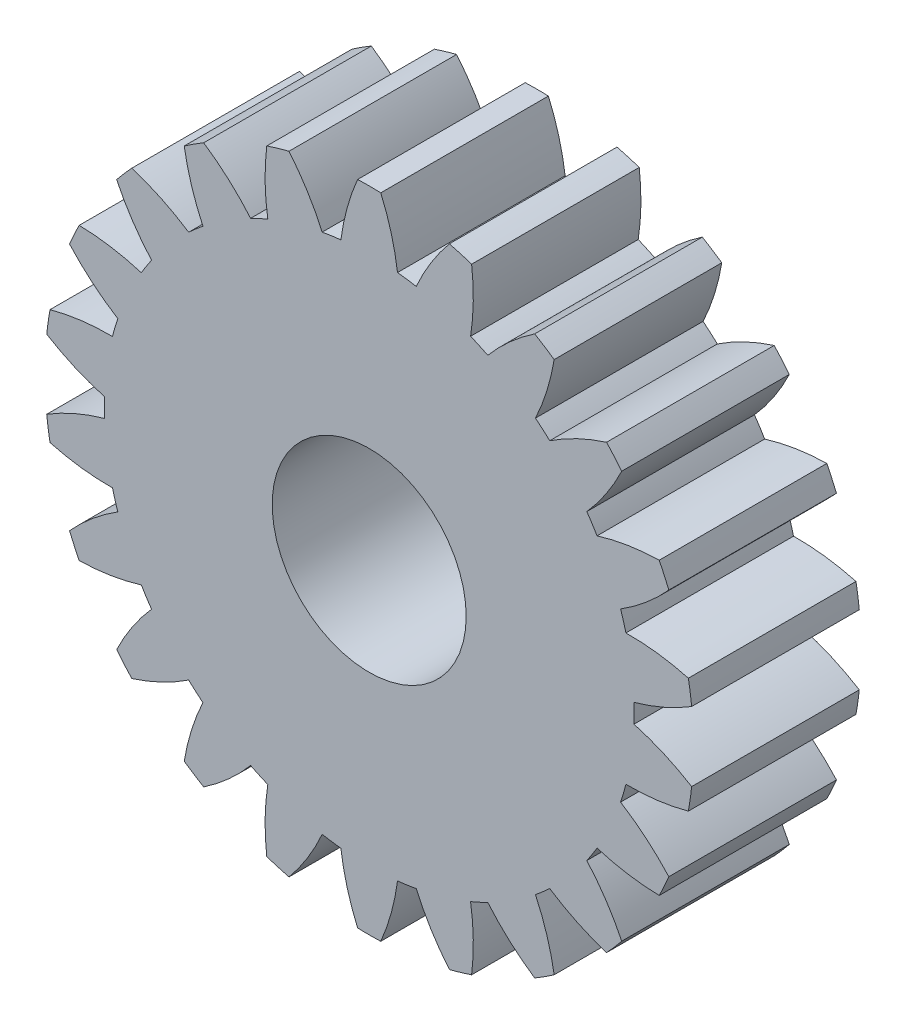
from build123d import *

# Parameters (mm, degrees)
SKETCH1_R           = 3.675
BOSS_EXTRUDE1_DEPTH = 6.35


with BuildPart() as part:
    # Sketch1 → Boss-Extrude1 (new body)
    with BuildSketch(Plane.XY.offset(6.35)):
        with BuildLine():
            ThreePointArc((-3.880007235, 11.657556143), (-3.94321083, 10.464048215), (-3.841100867, 9.273237808))
            ThreePointArc((-3.841100867, 9.273237808), (-4.169636916, 9.130231284), (-4.492859393, 8.975589663))
            ThreePointArc((-4.492859393, 8.975589663), (-5.325946046, 9.8325742), (-6.269328707, 10.566389588))
            ThreePointArc((-6.269328707, 10.566389588), (-6.642473156, 10.335889983), (-7.007152779, 10.092218849))
            ThreePointArc((-7.007152779, 10.092218849), (-6.731546143, 8.929249868), (-6.298082291, 7.815443351))
            ThreePointArc((-6.298082291, 7.815443351), (-6.573020728, 7.585670296), (-6.839582844, 7.346230451))
            ThreePointArc((-6.839582844, 7.346230451), (-7.880364079, 7.933793461), (-8.992272799, 8.37210256))
            ThreePointArc((-8.992272799, 8.37210256), (-9.285363033, 8.045812868), (-9.566620477, 7.709270006))
            ThreePointArc((-9.566620477, 7.709270006), (-8.974531622, 6.671056802), (-8.244830544, 5.724488154))
            ThreePointArc((-8.244830544, 5.724488154), (-8.443897491, 5.426563413), (-8.632203969, 5.121723338))
            ThreePointArc((-8.632203969, 5.121723338), (-9.79636188, 5.392263959), (-10.986716428, 5.499557573))
            ThreePointArc((-10.986716428, 5.499557573), (-11.176008019, 5.103911846), (-11.351057479, 4.701761955))
            ThreePointArc((-11.351057479, 4.701761955), (-10.490453922, 3.872414387), (-9.523631659, 3.169768972))
            ThreePointArc((-9.523631659, 3.169768972), (-9.630699898, 2.827828636), (-9.725495267, 2.48228466))
            ThreePointArc((-9.725495267, 2.48228466), (-10.918716703, 2.4138853), (-12.091081632, 2.181471139))
            ThreePointArc((-12.091081632, 2.181471139), (-12.161239301, 1.74852224), (-12.215899311, 1.313345113))
            ThreePointArc((-12.215899311, 1.313345113), (-11.156502035, 0.76005199), (-10.030884778, 0.358253958))
            ThreePointArc((-10.030884778, 0.358253958), (-10.037280275, 0), (-10.030884778, -0.358253958))
            ThreePointArc((-10.030884778, -0.358253958), (-11.156502035, -0.76005199), (-12.215899311, -1.313345113))
            ThreePointArc((-12.215899311, -1.313345113), (-12.161239301, -1.74852224), (-12.091081632, -2.181471139))
            ThreePointArc((-12.091081632, -2.181471139), (-10.918716703, -2.4138853), (-9.725495267, -2.48228466))
            ThreePointArc((-9.725495267, -2.48228466), (-9.630699898, -2.827828636), (-9.523631659, -3.169768972))
            ThreePointArc((-9.523631659, -3.169768972), (-10.490453922, -3.872414387), (-11.351057479, -4.701761955))
            ThreePointArc((-11.351057479, -4.701761955), (-11.176008019, -5.103911846), (-10.986716428, -5.499557573))
            ThreePointArc((-10.986716428, -5.499557573), (-9.79636188, -5.392263959), (-8.632203969, -5.121723338))
            ThreePointArc((-8.632203969, -5.121723338), (-8.443897491, -5.426563413), (-8.244830544, -5.724488154))
            ThreePointArc((-8.244830544, -5.724488154), (-8.974531622, -6.671056802), (-9.566620477, -7.709270006))
            ThreePointArc((-9.566620477, -7.709270006), (-9.285363033, -8.045812868), (-8.992272799, -8.37210256))
            ThreePointArc((-8.992272799, -8.37210256), (-7.880364079, -7.933793461), (-6.839582844, -7.346230451))
            ThreePointArc((-6.839582844, -7.346230451), (-6.573020728, -7.585670296), (-6.298082291, -7.815443351))
            ThreePointArc((-6.298082291, -7.815443351), (-6.731546143, -8.929249868), (-7.007152779, -10.092218849))
            ThreePointArc((-7.007152779, -10.092218849), (-6.642473156, -10.335889983), (-6.269328707, -10.566389588))
            ThreePointArc((-6.269328707, -10.566389588), (-5.325946046, -9.8325742), (-4.492859393, -8.975589663))
            ThreePointArc((-4.492859393, -8.975589663), (-4.169636916, -9.130231284), (-3.841100867, -9.273237808))
            ThreePointArc((-3.841100867, -9.273237808), (-3.94321083, -10.464048215), (-3.880007235, -11.657556143))
            ThreePointArc((-3.880007235, -11.657556143), (-3.461449609, -11.788614761), (-3.038480888, -11.904650573))
            ThreePointArc((-3.038480888, -11.904650573), (-2.340051539, -10.934778255), (-1.782151195, -9.87779998))
            ThreePointArc((-1.782151195, -9.87779998), (-1.428453919, -9.935115234), (-1.072936295, -9.979769688))
            ThreePointArc((-1.072936295, -9.979769688), (-0.835420026, -11.151111607), (-0.438526581, -12.278467567))
            ThreePointArc((-0.438526581, -12.278467567), (0, -12.28629608), (0.438526581, -12.278467567))
            ThreePointArc((0.438526581, -12.278467567), (0.835420026, -11.151111607), (1.072936295, -9.979769688))
            ThreePointArc((1.072936295, -9.979769688), (1.428453919, -9.935115234), (1.782151195, -9.87779998))
            ThreePointArc((1.782151195, -9.87779998), (2.340051539, -10.934778255), (3.038480888, -11.904650573))
            ThreePointArc((3.038480888, -11.904650573), (3.461449609, -11.788614761), (3.880007235, -11.657556143))
            ThreePointArc((3.880007235, -11.657556143), (3.94321083, -10.464048215), (3.841100867, -9.273237808))
            ThreePointArc((3.841100867, -9.273237808), (4.169636916, -9.130231284), (4.492859393, -8.975589663))
            ThreePointArc((4.492859393, -8.975589663), (5.325946046, -9.8325742), (6.269328707, -10.566389588))
            ThreePointArc((6.269328707, -10.566389588), (6.642473156, -10.335889983), (7.007152779, -10.092218849))
            ThreePointArc((7.007152779, -10.092218849), (6.731546143, -8.929249868), (6.298082291, -7.815443351))
            ThreePointArc((6.298082291, -7.815443351), (6.573020728, -7.585670296), (6.839582844, -7.346230451))
            ThreePointArc((6.839582844, -7.346230451), (7.880364079, -7.933793461), (8.992272799, -8.37210256))
            ThreePointArc((8.992272799, -8.37210256), (9.285363033, -8.045812868), (9.566620477, -7.709270006))
            ThreePointArc((9.566620477, -7.709270006), (8.974531622, -6.671056802), (8.244830544, -5.724488154))
            ThreePointArc((8.244830544, -5.724488154), (8.443897491, -5.426563413), (8.632203969, -5.121723338))
            ThreePointArc((8.632203969, -5.121723338), (9.79636188, -5.392263959), (10.986716428, -5.499557573))
            ThreePointArc((10.986716428, -5.499557573), (11.176008019, -5.103911846), (11.351057479, -4.701761955))
            ThreePointArc((11.351057479, -4.701761955), (10.490453922, -3.872414387), (9.523631659, -3.169768972))
            ThreePointArc((9.523631659, -3.169768972), (9.630699898, -2.827828636), (9.725495267, -2.48228466))
            ThreePointArc((9.725495267, -2.48228466), (10.918716703, -2.4138853), (12.091081632, -2.181471139))
            ThreePointArc((12.091081632, -2.181471139), (12.161239301, -1.74852224), (12.215899311, -1.313345113))
            ThreePointArc((12.215899311, -1.313345113), (11.156502035, -0.76005199), (10.030884778, -0.358253958))
            ThreePointArc((10.030884778, -0.358253958), (10.037280275, 0), (10.030884778, 0.358253958))
            ThreePointArc((10.030884778, 0.358253958), (11.156502035, 0.76005199), (12.215899311, 1.313345113))
            ThreePointArc((12.215899311, 1.313345113), (12.161239301, 1.74852224), (12.091081632, 2.181471139))
            ThreePointArc((12.091081632, 2.181471139), (10.918716703, 2.4138853), (9.725495267, 2.48228466))
            ThreePointArc((9.725495267, 2.48228466), (9.630699898, 2.827828636), (9.523631659, 3.169768972))
            ThreePointArc((9.523631659, 3.169768972), (10.490453922, 3.872414387), (11.351057479, 4.701761955))
            ThreePointArc((11.351057479, 4.701761955), (11.176008019, 5.103911846), (10.986716428, 5.499557573))
            ThreePointArc((10.986716428, 5.499557573), (9.79636188, 5.392263959), (8.632203969, 5.121723338))
            ThreePointArc((8.632203969, 5.121723338), (8.443897491, 5.426563413), (8.244830544, 5.724488154))
            ThreePointArc((8.244830544, 5.724488154), (8.974531622, 6.671056802), (9.566620477, 7.709270006))
            ThreePointArc((9.566620477, 7.709270006), (9.285363033, 8.045812868), (8.992272799, 8.37210256))
            ThreePointArc((8.992272799, 8.37210256), (7.880364079, 7.933793461), (6.839582844, 7.346230451))
            ThreePointArc((6.839582844, 7.346230451), (6.573020728, 7.585670296), (6.298082291, 7.815443351))
            ThreePointArc((6.298082291, 7.815443351), (6.731546143, 8.929249868), (7.007152779, 10.092218849))
            ThreePointArc((7.007152779, 10.092218849), (6.642473156, 10.335889983), (6.269328707, 10.566389588))
            ThreePointArc((6.269328707, 10.566389588), (5.325946046, 9.8325742), (4.492859393, 8.975589663))
            ThreePointArc((4.492859393, 8.975589663), (4.169636916, 9.130231284), (3.841100867, 9.273237808))
            ThreePointArc((3.841100867, 9.273237808), (3.94321083, 10.464048215), (3.880007235, 11.657556143))
            ThreePointArc((3.880007235, 11.657556143), (3.461449609, 11.788614761), (3.038480888, 11.904650573))
            ThreePointArc((3.038480888, 11.904650573), (2.340051539, 10.934778255), (1.782151195, 9.87779998))
            ThreePointArc((1.782151195, 9.87779998), (1.428453919, 9.935115234), (1.072936295, 9.979769688))
            ThreePointArc((1.072936295, 9.979769688), (0.835420026, 11.151111607), (0.438526581, 12.278467567))
            ThreePointArc((0.438526581, 12.278467567), (0, 12.28629608), (-0.438526581, 12.278467567))
            ThreePointArc((-0.438526581, 12.278467567), (-0.835420026, 11.151111607), (-1.072936295, 9.979769688))
            ThreePointArc((-1.072936295, 9.979769688), (-1.428453919, 9.935115234), (-1.782151195, 9.87779998))
            ThreePointArc((-1.782151195, 9.87779998), (-2.340051539, 10.934778255), (-3.038480888, 11.904650573))
            ThreePointArc((-3.038480888, 11.904650573), (-3.461449609, 11.788614761), (-3.880007235, 11.657556143))
        make_face()
        Circle(SKETCH1_R, mode=Mode.SUBTRACT)
    extrude(amount=-BOSS_EXTRUDE1_DEPTH)


solid = part.part
